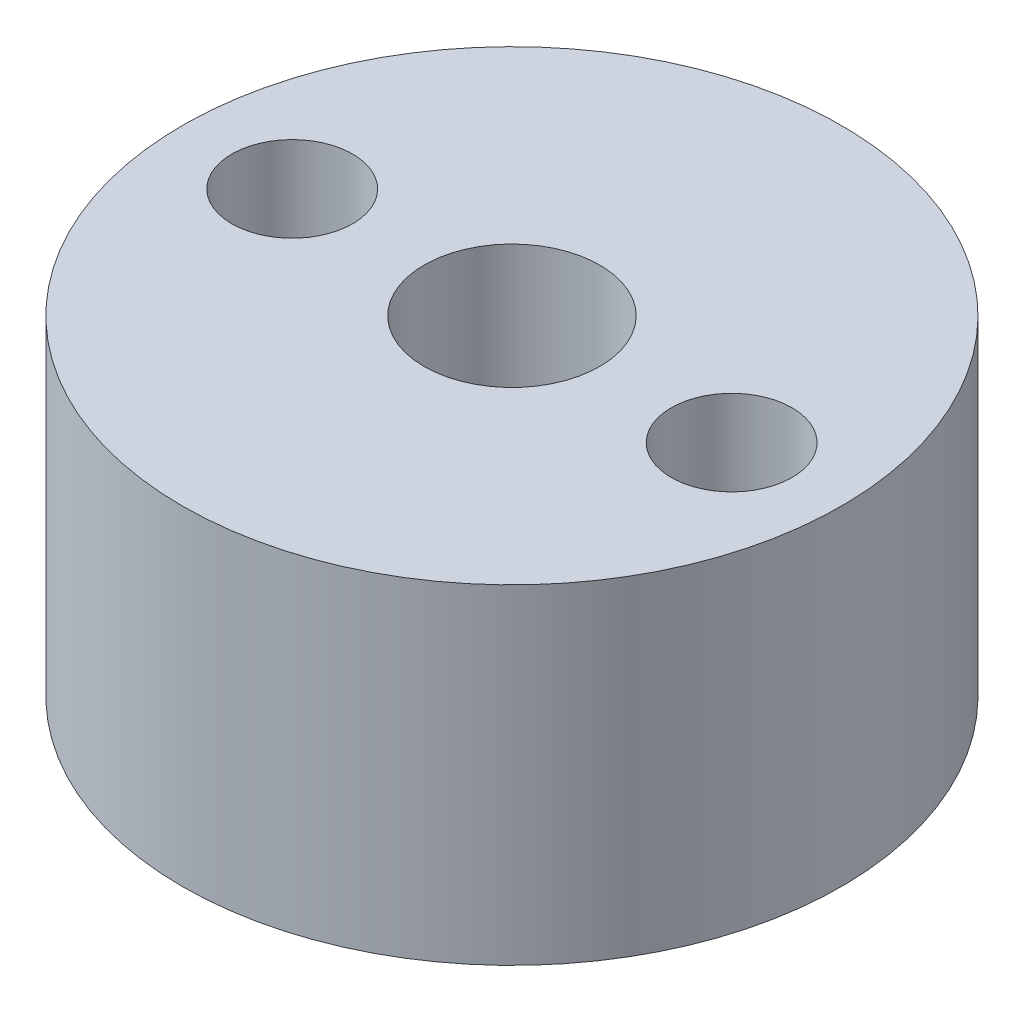
from build123d import *

# Parameters (mm, degrees)
SKETCH1_R           = 15
SKETCH1_R_2         = 4
SKETCH1_R_3         = 2.75
BOSS_EXTRUDE1_DEPTH = 15


with BuildPart() as part:
    # Sketch1 → Boss-Extrude1 (new body)
    with BuildSketch(Plane(origin=(0, 0, 0), x_dir=(1, 0, 0), z_dir=(0, 1, 0))):
        with Locations(Location((0, 0, 0), (0, 0, 270))):
            Circle(SKETCH1_R)
        with Locations(Location((0, 0, 0), (0, 0, 270))):
            Circle(SKETCH1_R_2, mode=Mode.SUBTRACT)
        with Locations(Location((-10, 0, 0), (0, 0, 270))):
            Circle(SKETCH1_R_3, mode=Mode.SUBTRACT)
        with Locations(Location((10, 0, 0), (0, 0, 90))):
            Circle(SKETCH1_R_3, mode=Mode.SUBTRACT)
    extrude(amount=BOSS_EXTRUDE1_DEPTH)


solid = part.part
